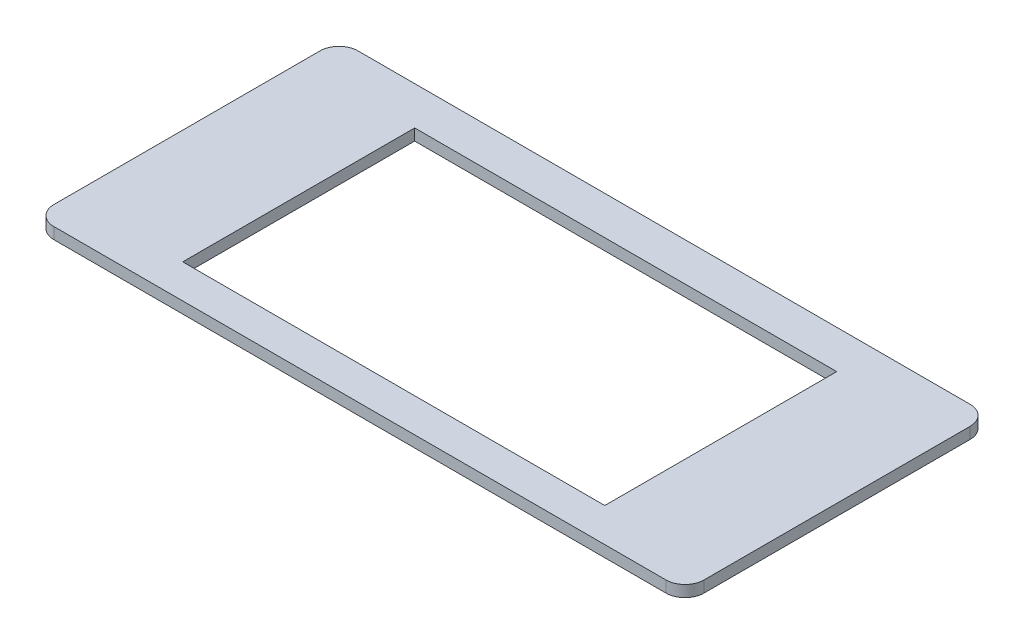
from build123d import *

# Parameters (mm, degrees)
BOSS_EXTRUDE1_DEPTH     = 3
CUT_EXTRUDE1_DEPTH      = 5
CUT_EXTRUDE1_DEPTH_BACK = 3
SKETCH2_W               = 111
SKETCH2_H               = 61


with BuildPart() as part:
    # Sketch1 → Boss-Extrude1 (new body)
    with BuildSketch(Plane(origin=(0, 0, 0), x_dir=(1, 0, 0), z_dir=(0, 1, 0))):
        with BuildLine():
            Line((-75.361284995, 38.602305476), (85.638715005, 38.602305476))
            ThreePointArc((85.638715005, 38.602305476), (89.174248911, 37.137839381), (90.638715005, 33.602305476))
            Line((90.638715005, 33.602305476), (90.638715005, -36.397694524))
            ThreePointArc((90.638715005, -36.397694524), (89.174248911, -39.93322843), (85.638715005, -41.397694524))
            Line((85.638715005, -41.397694524), (-75.361284995, -41.397694524))
            ThreePointArc((-75.361284995, -41.397694524), (-78.896818901, -39.93322843), (-80.361284995, -36.397694524))
            Line((-80.361284995, -36.397694524), (-80.361284995, 33.602305476))
            ThreePointArc((-80.361284995, 33.602305476), (-78.896818901, 37.137839381), (-75.361284995, 38.602305476))
        make_face()
    extrude(amount=BOSS_EXTRUDE1_DEPTH)

    # Sketch2 → Cut-Extrude1 (cut, two sides: drawn at the far end of the back side and taken through both)
    with BuildSketch(Plane(origin=(0, 0, 0), x_dir=(1, 0, 0), z_dir=(0, 1, 0)).offset(-CUT_EXTRUDE1_DEPTH_BACK)):
        with Locations((5.138715005, -1.994135041)):
            Rectangle(SKETCH2_W, SKETCH2_H)
    extrude(amount=CUT_EXTRUDE1_DEPTH + CUT_EXTRUDE1_DEPTH_BACK, mode=Mode.SUBTRACT)


solid = part.part
